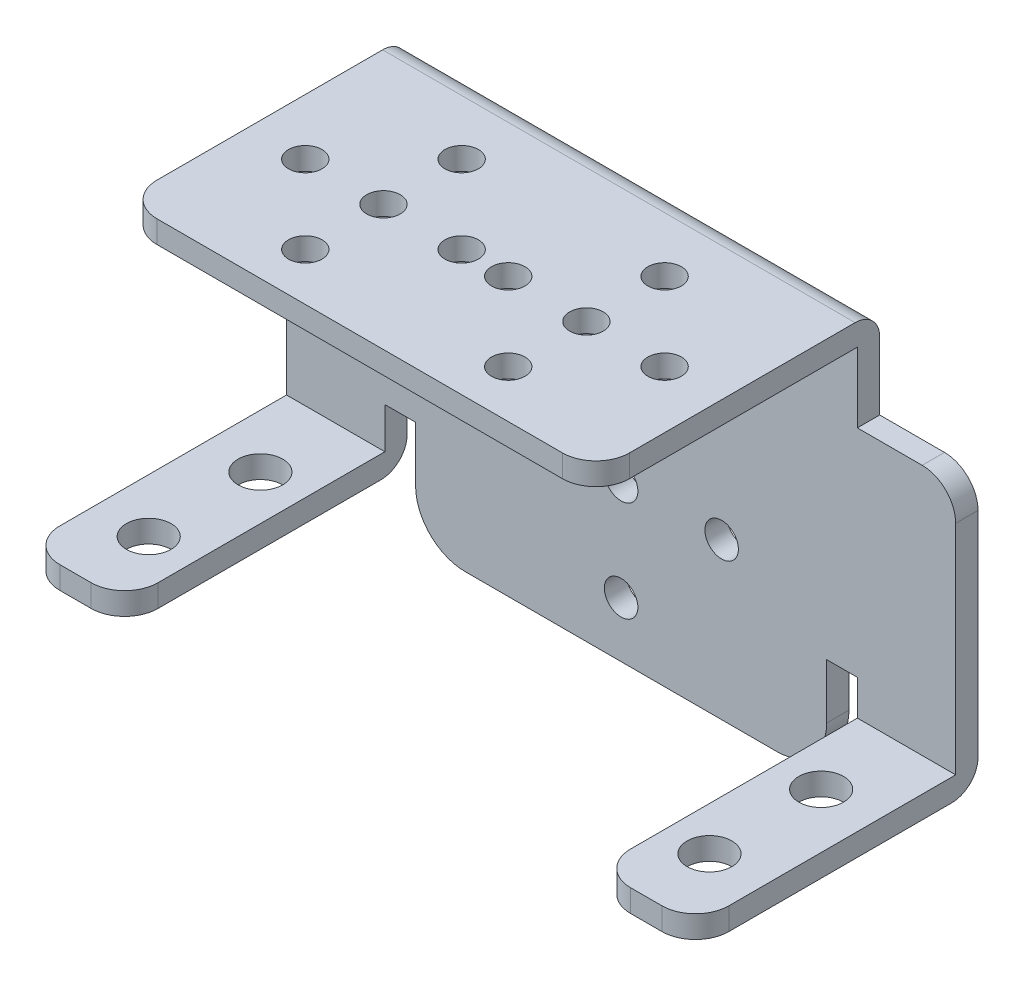
from build123d import *

# Parameters (mm, degrees)
BOSS_EXTRUDE1_DEPTH = 2
SKETCH1_3_W         = 42.3
SKETCH1_3_H         = 2
BOSS_EXTRUDE2_DEPTH = 25.4
SKETCH1_4_W         = 8.8
SKETCH1_4_H         = 2
BOSS_EXTRUDE3_DEPTH = 25.3
FILLET13_R          = 3
FILLET14_R          = 3
FILLET15_R          = 3
FILLET16_R          = 3
FILLET18_R          = 3
FILLET19_R          = 3
FILLET20_R          = 3
FILLET21_R          = 3
FILLET24_R          = 2.36
FILLET25_R          = 2.36
FILLET26_R          = 2.2
SKETCH2_R           = 2
CUT_EXTRUDE1_DEPTH  = 10
SKETCH3_R           = 1.5
CUT_EXTRUDE2_DEPTH  = 10
SKETCH4_R           = 1.5
CUT_EXTRUDE3_DEPTH  = 10


with BuildPart() as part:
    # Sketch1 → Boss-Extrude1 (new body)
    with BuildSketch(Plane.XY):
        Polygon((21.15, 16.48), (-21.15, 16.48), (-21.15, 9.72), (-21.15, -9.12), (-18.4, -9.12), (18.4, -9.12), (21.15, -9.12), (21.15, 10.22), align=None)
        with BuildLine():
            Line((-4.349812535, -18.48), (13.96, -18.48))
            ThreePointArc((13.96, -18.48), (17.099554108, -17.179554108), (18.4, -14.04))
            Line((18.4, -14.04), (18.4, -9.12))
            Line((18.4, -9.12), (-18.4, -9.12))
            Line((-18.4, -9.12), (-18.4, -14.04))
            ThreePointArc((-18.4, -14.04), (-17.099554108, -17.179554108), (-13.96, -18.48))
            Line((-13.96, -18.48), (-4.349812535, -18.48))
        make_face()
        Polygon((-21.15, -9.12), (-21.15, 9.72), (-29.95, 9.72), (-29.95, -12.78), (-21.15, -12.78), align=None)
        Polygon((29.95, 10.22), (21.15, 10.22), (21.15, -9.12), (21.15, -12.28), (29.95, -12.28), align=None)
    extrude(amount=BOSS_EXTRUDE1_DEPTH)

    # Sketch1<3> → Boss-Extrude2 (add)
    with BuildSketch(Plane.XY):
        with Locations((0, 17.48)):
            Rectangle(SKETCH1_3_W, SKETCH1_3_H)
    extrude(amount=BOSS_EXTRUDE2_DEPTH)

    # Sketch1<4> → Boss-Extrude3 (add)
    with BuildSketch(Plane.XY):
        with Locations((-25.55, -13.78)):
            Rectangle(SKETCH1_4_W, SKETCH1_4_H)
        with Locations((25.55, -13.28)):
            Rectangle(SKETCH1_4_W, SKETCH1_4_H)
    extrude(amount=BOSS_EXTRUDE3_DEPTH)

    # Fillet13
    fillet13_edges = [part.edges().sort_by_distance(p)[0] for p in [
        (-21.15, -13.78, 25.3),
    ]]
    fillet(fillet13_edges, radius=FILLET13_R)

    # Fillet14
    fillet14_edges = [part.edges().sort_by_distance(p)[0] for p in [
        (-29.95, -13.78, 25.3),
    ]]
    fillet(fillet14_edges, radius=FILLET14_R)

    # Fillet15
    fillet15_edges = [part.edges().sort_by_distance(p)[0] for p in [
        (29.95, -13.28, 25.3),
    ]]
    fillet(fillet15_edges, radius=FILLET15_R)

    # Fillet16
    fillet16_edges = [part.edges().sort_by_distance(p)[0] for p in [
        (21.15, -13.28, 25.3),
    ]]
    fillet(fillet16_edges, radius=FILLET16_R)

    # Fillet18
    fillet18_edges = [part.edges().sort_by_distance(p)[0] for p in [
        (21.15, 17.48, 25.4),
    ]]
    fillet(fillet18_edges, radius=FILLET18_R)

    # Fillet19
    fillet19_edges = [part.edges().sort_by_distance(p)[0] for p in [
        (-21.15, 17.48, 25.4),
    ]]
    fillet(fillet19_edges, radius=FILLET19_R)

    # Fillet20
    fillet20_edges = [part.edges().sort_by_distance(p)[0] for p in [
        (29.95, 10.22, 1),
    ]]
    fillet(fillet20_edges, radius=FILLET20_R)

    # Fillet21
    fillet21_edges = [part.edges().sort_by_distance(p)[0] for p in [
        (-29.95, 9.72, 1),
    ]]
    fillet(fillet21_edges, radius=FILLET21_R)

    # Fillet24
    fillet24_edges = [part.edges().sort_by_distance(p)[0] for p in [
        (-25.55, -14.78, 0),
    ]]
    fillet(fillet24_edges, radius=FILLET24_R)

    # Fillet25
    fillet25_edges = [part.edges().sort_by_distance(p)[0] for p in [
        (25.55, -14.28, 0),
    ]]
    fillet(fillet25_edges, radius=FILLET25_R)

    # Fillet26
    fillet26_edges = [part.edges().sort_by_distance(p)[0] for p in [
        (0, 18.48, 0),
    ]]
    fillet(fillet26_edges, radius=FILLET26_R)

    # Sketch2 → Cut-Extrude1 (cut, symmetric)
    with BuildSketch(Plane.XZ.offset(14.28)):
        with Locations(Location((25.05, 19.14, 0), (0, 0, 180))):
            Circle(SKETCH2_R)
        with Locations(Location((25.05, 9.14, 0), (0, 0, 180))):
            Circle(SKETCH2_R)
        with Locations(Location((-25.15, 19.14, 0), (0, 0, 180))):
            Circle(SKETCH2_R)
        with Locations(Location((-25.15, 9.14, 0), (0, 0, 180))):
            Circle(SKETCH2_R)
    extrude(amount=CUT_EXTRUDE1_DEPTH, both=True, mode=Mode.SUBTRACT)

    # Sketch3 → Cut-Extrude2 (cut)
    with BuildSketch(Plane(origin=(0, 18.48, 0), x_dir=(1, 0, 0), z_dir=(0, 1, 0))):
        with Locations(Location((-9.134575671, -14.14, 0), (0, 0, 270))):
            Circle(SKETCH3_R)
        with Locations(Location((-9.134575671, -7.14, 0), (0, 0, 270))):
            Circle(SKETCH3_R)
        with Locations(Location((-2.134575671, -14.14, 0), (0, 0, 270))):
            Circle(SKETCH3_R)
        with Locations(Location((-9.134575671, -21.14, 0), (0, 0, 270))):
            Circle(SKETCH3_R)
        with Locations(Location((-16.134575671, -14.14, 0), (0, 0, 270))):
            Circle(SKETCH3_R)
        with Locations(Location((9.034575671, -14.14, 0), (0, 0, 270))):
            Circle(SKETCH3_R)
        with Locations(Location((9.034575671, -7.14, 0), (0, 0, 270))):
            Circle(SKETCH3_R)
        with Locations(Location((16.034575671, -14.14, 0), (0, 0, 270))):
            Circle(SKETCH3_R)
        with Locations(Location((9.034575671, -21.14, 0), (0, 0, 270))):
            Circle(SKETCH3_R)
        with Locations(Location((2.034575671, -14.14, 0), (0, 0, 270))):
            Circle(SKETCH3_R)
    extrude(amount=-CUT_EXTRUDE2_DEPTH, mode=Mode.SUBTRACT)

    # Sketch4 → Cut-Extrude3 (cut)
    with BuildSketch(Plane(origin=(0, 0, 0), x_dir=(-1, 0, 0), z_dir=(0, 0, -1))):
        with Locations((-9, -4.52)):
            Circle(SKETCH4_R)
        with Locations((0, 4.48)):
            Circle(SKETCH4_R)
        with Locations((9, -4.52)):
            Circle(SKETCH4_R)
        with Locations((0, -13.52)):
            Circle(SKETCH4_R)
        with Locations((0, -4.52)):
            Circle(SKETCH4_R)
    extrude(amount=-CUT_EXTRUDE3_DEPTH, mode=Mode.SUBTRACT)


solid = part.part
